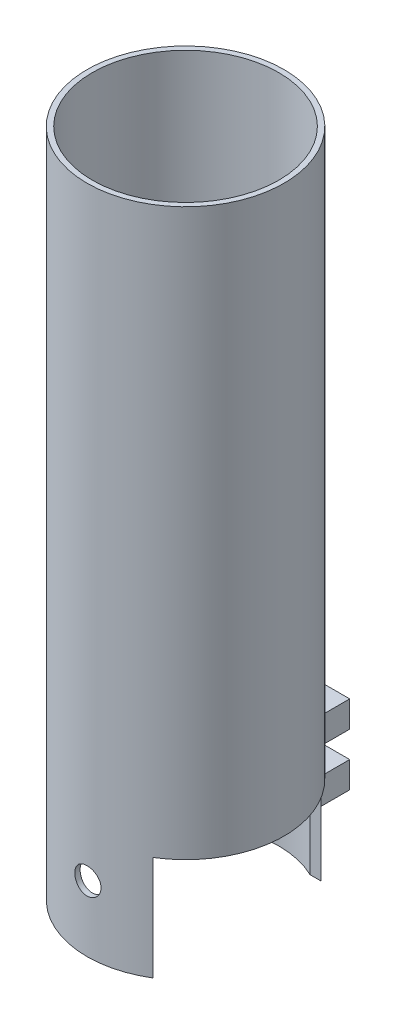
from build123d import *

# Parameters (mm, degrees)
SKETCH1_R               = 37.5
SKETCH1_R_2             = 35.5
BOSS_EXTRUDE1_DEPTH     = 255
CUT_EXTRUDE1_DEPTH      = 261.456330313
CUT_EXTRUDE1_DEPTH_BACK = 261.456330313
SKETCH2_R               = 5
SKETCH3_W               = 10
SKETCH3_H               = 10
BOSS_EXTRUDE2_DEPTH     = 20
BOSS_EXTRUDE2_2_DEPTH   = 20
SKETCH4_W               = 63.955545956
SKETCH4_H               = 79.134684629
CUT_EXTRUDE2_DEPTH      = 265.078586899


with BuildPart() as part:
    # Sketch1 → Boss-Extrude1 (new body)
    with BuildSketch(Plane(origin=(0, 0, 0), x_dir=(1, 0, 0), z_dir=(0, 1, 0))):
        with Locations(Location((0, 0, 0), (0, 0, 270))):
            Circle(SKETCH1_R)
        with Locations(Location((0, 0, 0), (0, 0, 270))):
            Circle(SKETCH1_R_2, mode=Mode.SUBTRACT)
    extrude(amount=BOSS_EXTRUDE1_DEPTH)

    # Sketch2 → Cut-Extrude1 (cut, two sides: drawn at the far end of the back side and taken through both)
    with BuildSketch(Plane.XY.offset(-CUT_EXTRUDE1_DEPTH_BACK)):
        with Locations((0, 25)):
            Circle(SKETCH2_R)
    extrude(amount=CUT_EXTRUDE1_DEPTH + CUT_EXTRUDE1_DEPTH_BACK, mode=Mode.SUBTRACT)

    # Sketch4 → Cut-Extrude2 (cut, through all)
    with BuildSketch(Plane(origin=(0, 0, 0), x_dir=(0, 0, -1), z_dir=(1, 0, 0))):
        with Locations((0, 0.164686538)):
            Rectangle(SKETCH4_W, SKETCH4_H)
    extrude(amount=CUT_EXTRUDE2_DEPTH, mode=Mode.SUBTRACT)


with BuildPart() as body_2:
    # Sketch3 → Boss-Extrude2 (new body)
    with BuildSketch(Plane(origin=(0, 0, -37.5), x_dir=(-1, 0, 0), z_dir=(0, 0, -1))):
        with Locations((0, 35)):
            Rectangle(SKETCH3_W, SKETCH3_H)
    extrude(amount=BOSS_EXTRUDE2_DEPTH)


with BuildPart() as body_3:
    # Sketch3 → Boss-Extrude2 2 (new body)
    with BuildSketch(Plane(origin=(0, 0, -37.5), x_dir=(-1, 0, 0), z_dir=(0, 0, -1))):
        with Locations((0, 15)):
            Rectangle(SKETCH3_W, SKETCH3_H)
    extrude(amount=BOSS_EXTRUDE2_2_DEPTH)


solid = Compound([part.part, body_2.part, body_3.part])
